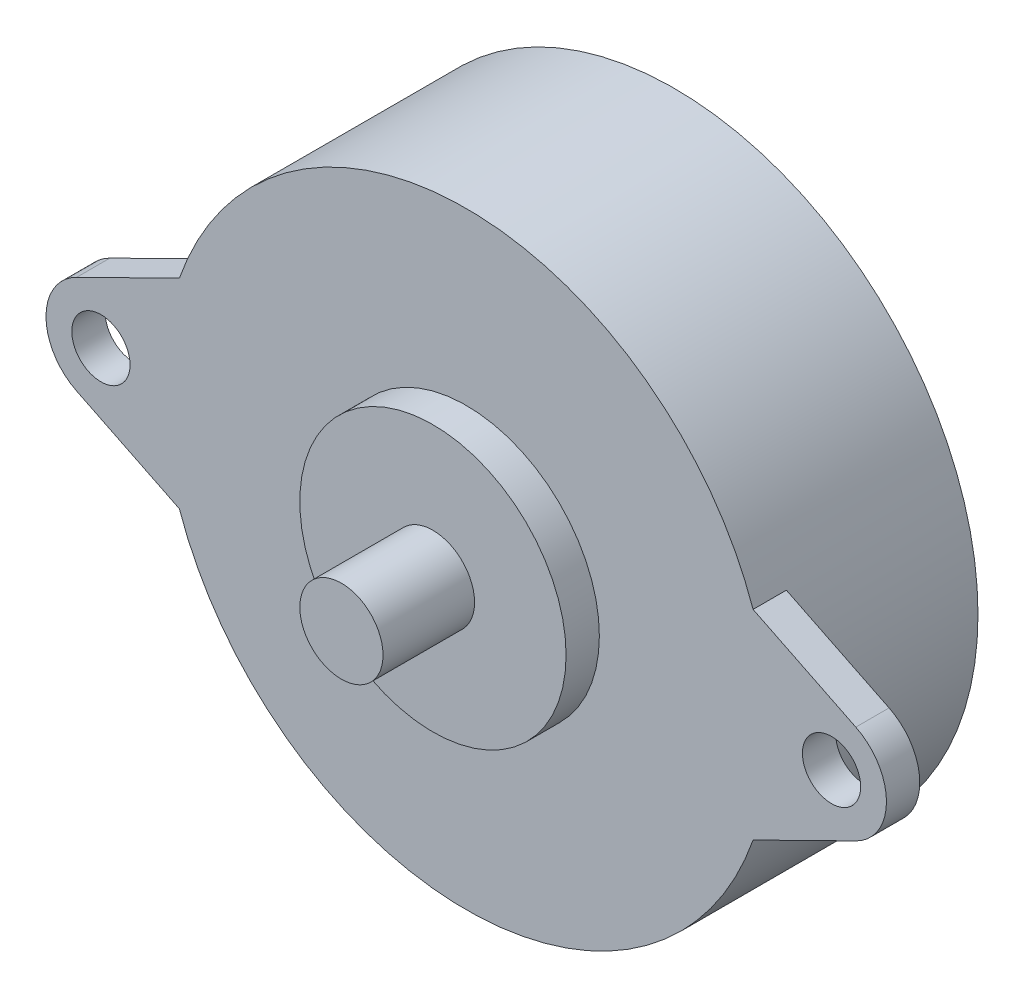
from build123d import *

# Parameters (mm, degrees)
SKETCH1_R           = 18.25
BOSS_EXTRUDE1_DEPTH = 12.5
BOSS_EXTRUDE2_START = -2
SKETCH2_R           = 1.75
BOSS_EXTRUDE2_DEPTH = 2
SKETCH3_R           = 8
BOSS_EXTRUDE3_DEPTH = 2
SKETCH4_R           = 2.5
BOSS_EXTRUDE4_DEPTH = 5.5


with BuildPart() as part:
    # Sketch1 → Boss-Extrude1 (new body)
    with BuildSketch(Plane.XY):
        Circle(SKETCH1_R)
    extrude(amount=BOSS_EXTRUDE1_DEPTH)

    # Sketch2 → Boss-Extrude2 (add)
    # profile 1 of 2: a face of its own
    with BuildSketch(Plane.XY.offset(12.5).offset(BOSS_EXTRUDE2_START)):
        with BuildLine():
            Line((-23.407860756, 2.960513809), (-17.235501153, 6))
            ThreePointArc((-17.235501153, 6), (-18.25, 0), (-17.235501153, -6))
            Line((-17.235501153, -6), (-23.407860756, -2.960513809))
            ThreePointArc((-23.407860756, -2.960513809), (-25.25, 0), (-23.407860756, 2.960513809))
        make_face()
        with Locations((-21.95, 0)):
            Circle(SKETCH2_R, mode=Mode.SUBTRACT)
    # profile 2 of 2: a face of its own
    with BuildSketch(Plane.XY.offset(12.5).offset(BOSS_EXTRUDE2_START)):
        with BuildLine():
            Line((23.407860756, 2.960513809), (17.235501153, 6))
            ThreePointArc((17.235501153, 6), (18.25, 0), (17.235501153, -6))
            Line((17.235501153, -6), (23.407860756, -2.960513809))
            ThreePointArc((23.407860756, -2.960513809), (25.25, 0), (23.407860756, 2.960513809))
        make_face()
        with Locations((21.95, 0)):
            Circle(SKETCH2_R, mode=Mode.SUBTRACT)
    extrude(amount=BOSS_EXTRUDE2_DEPTH)

    # Sketch3 → Boss-Extrude3 (add)
    with BuildSketch(Plane.XY.offset(12.5)):
        Circle(SKETCH3_R)
    extrude(amount=BOSS_EXTRUDE3_DEPTH)

    # Sketch4 → Boss-Extrude4 (add)
    with BuildSketch(Plane.XY.offset(14.5)):
        Circle(SKETCH4_R)
    extrude(amount=BOSS_EXTRUDE4_DEPTH)


solid = part.part
